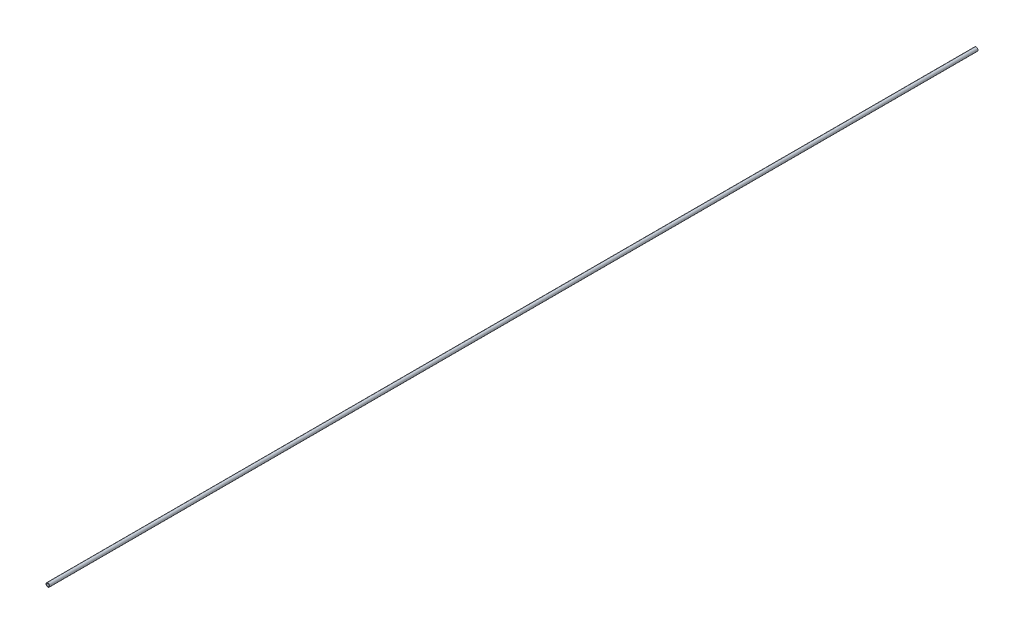
from build123d import *

# Parameters (mm, degrees)
SKETCH1_R           = 3
SKETCH1_R_2         = 2
BOSS_EXTRUDE1_DEPTH = 1500


with BuildPart() as part:
    # Sketch1 → Boss-Extrude1 (new body)
    with BuildSketch(Plane.XY):
        Circle(SKETCH1_R)
        Circle(SKETCH1_R_2, mode=Mode.SUBTRACT)
    extrude(amount=BOSS_EXTRUDE1_DEPTH)


solid = part.part
